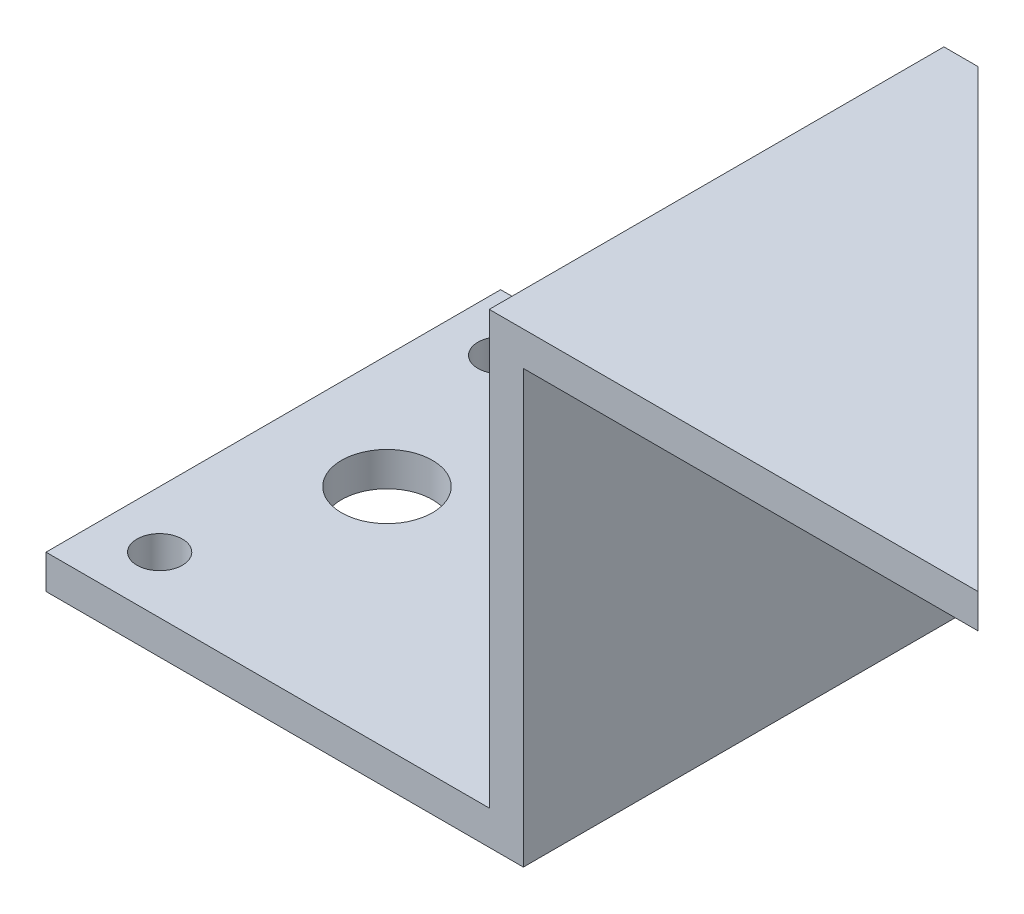
from build123d import *

# Parameters (mm, degrees)
SKETCH1_W           = 42
SKETCH1_H           = 40
SKETCH1_R           = 2
SKETCH1_R_2         = 4
BOSS_EXTRUDE1_DEPTH = 3
SKETCH2_W           = 3
SKETCH2_H           = 40
BOSS_EXTRUDE2_DEPTH = 38
SKETCH3_W           = 40
SKETCH3_H           = 3
BOSS_EXTRUDE3_DEPTH = 40
CUT_EXTRUDE3_DEPTH  = 3


with BuildPart() as part:
    # Sketch1 → Boss-Extrude1 (new body)
    with BuildSketch(Plane(origin=(0, 0, 0), x_dir=(1, 0, 0), z_dir=(0, 1, 0))):
        Rectangle(SKETCH1_W, SKETCH1_H)
        with Locations(Location((-16, 15, 0), (0, 0, 270))):
            Circle(SKETCH1_R, mode=Mode.SUBTRACT)
        with Locations(Location((-16, -15, 0), (0, 0, 270))):
            Circle(SKETCH1_R, mode=Mode.SUBTRACT)
        with Locations(Location((-11, 0, 0), (0, 0, 270))):
            Circle(SKETCH1_R_2, mode=Mode.SUBTRACT)
    extrude(amount=BOSS_EXTRUDE1_DEPTH)

    # Sketch2 → Boss-Extrude2 (add)
    with BuildSketch(Plane(origin=(0, 3, 0), x_dir=(1, 0, 0), z_dir=(0, 1, 0))):
        with Locations((19.5, 0)):
            Rectangle(SKETCH2_W, SKETCH2_H)
    extrude(amount=BOSS_EXTRUDE2_DEPTH)

    # Sketch3 → Boss-Extrude3 (add)
    with BuildSketch(Plane(origin=(21, 0, 0), x_dir=(0, 0, -1), z_dir=(1, 0, 0))):
        with Locations((0, 39.5)):
            Rectangle(SKETCH3_W, SKETCH3_H)
    extrude(amount=BOSS_EXTRUDE3_DEPTH)

    # Sketch8 → Cut-Extrude3 (cut)
    with BuildSketch(Plane.XZ.offset(-38)):
        Polygon((21, -20), (61, 20), (61, -20), align=None)
    extrude(amount=-CUT_EXTRUDE3_DEPTH, mode=Mode.SUBTRACT)


solid = part.part
